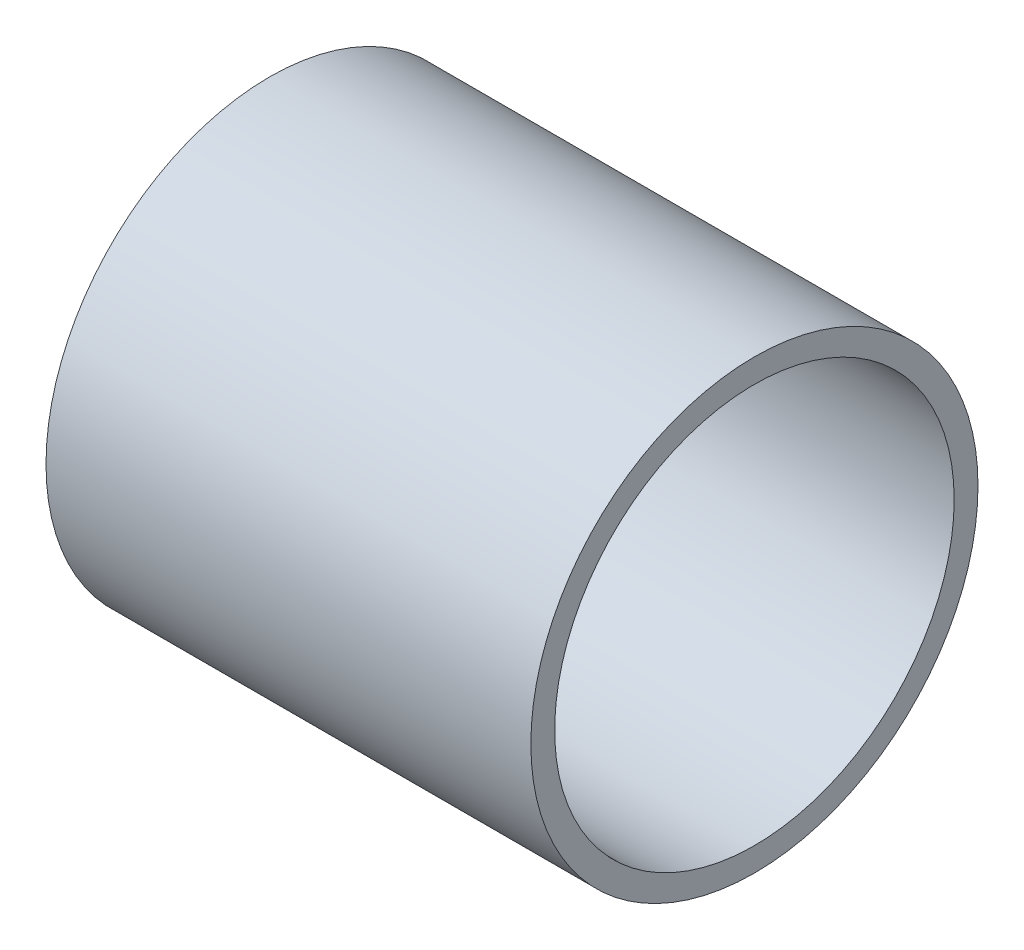
from build123d import *

# Parameters (mm, degrees)
SKETCH3_R           = 11.712575
SKETCH3_R_2         = 10.4648
BOSS_EXTRUDE1_DEPTH = 25.4


with BuildPart() as part:
    # Sketch3 → Boss-Extrude1 (new body)
    with BuildSketch(Plane(origin=(0, 0, 0), x_dir=(0, 0, -1), z_dir=(1, 0, 0))):
        Circle(SKETCH3_R)
        Circle(SKETCH3_R_2, mode=Mode.SUBTRACT)
    extrude(amount=BOSS_EXTRUDE1_DEPTH)


solid = part.part
